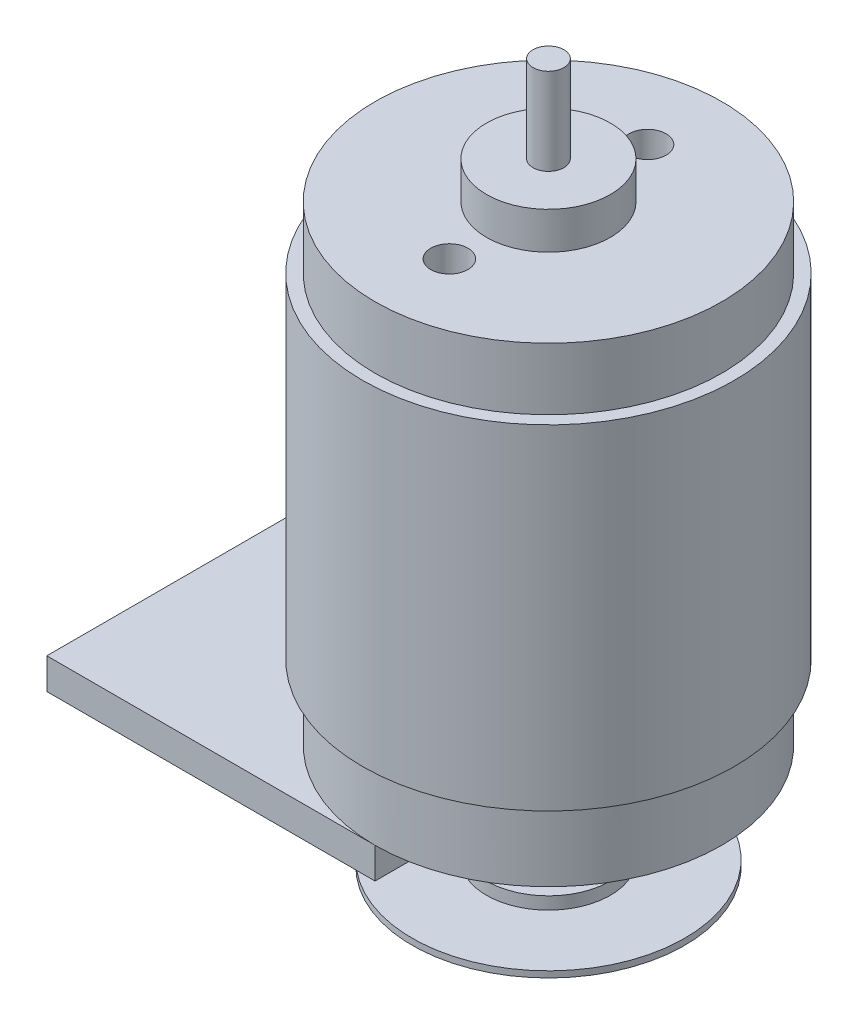
from build123d import *

# Parameters (mm, degrees)
SKETCH1_R            = 15
BOSS_EXTRUDE1_DEPTH  = 27
SKETCH2_R            = 14
BOSS_EXTRUDE2_DEPTH  = 5
SKETCH3_R            = 5
BOSS_EXTRUDE3_DEPTH  = 3
SKETCH4_R            = 1.25
BOSS_EXTRUDE4_DEPTH  = 7
BOSS_EXTRUDE5_START  = 6
SKETCH5_R            = 14
BOSS_EXTRUDE5_DEPTH  = 6
BOSS_EXTRUDE6_START  = 3
SKETCH6_R            = 5
BOSS_EXTRUDE6_DEPTH  = 3
SKETCH7_W            = 26.5
SKETCH7_H            = 28
BOSS_EXTRUDE7_DEPTH  = 2.5
BOSS_EXTRUDE8_START  = 4
SKETCH8_R            = 1.25
BOSS_EXTRUDE8_DEPTH  = 4
BOSS_EXTRUDE9_START  = 1
SKETCH9_R            = 5
BOSS_EXTRUDE9_DEPTH  = 1
SKETCH10_R           = 11
BOSS_EXTRUDE10_DEPTH = 0.5
BOSS_EXTRUDE11_START = 1
SKETCH11_R           = 5
BOSS_EXTRUDE11_DEPTH = 1
BOSS_EXTRUDE12_START = 3
SKETCH12_R           = 1.25
BOSS_EXTRUDE12_DEPTH = 3
SKETCH13_R           = 1.5
CUT_EXTRUDE1_DEPTH   = 20


with BuildPart() as part:
    # Sketch1 → Boss-Extrude1 (new body)
    with BuildSketch(Plane(origin=(0, 0, 0), x_dir=(1, 0, 0), z_dir=(0, 1, 0))):
        with Locations(Location((0, 0, 0), (0, 0, 270))):
            Circle(SKETCH1_R)
    extrude(amount=BOSS_EXTRUDE1_DEPTH)

    # Sketch2 → Boss-Extrude2 (add)
    with BuildSketch(Plane(origin=(0, 27, 0), x_dir=(1, 0, 0), z_dir=(0, 1, 0))):
        with Locations(Location((0, 0, 0), (0, 0, 270))):
            Circle(SKETCH2_R)
    extrude(amount=BOSS_EXTRUDE2_DEPTH)

    # Sketch3 → Boss-Extrude3 (add)
    with BuildSketch(Plane(origin=(0, 32, 0), x_dir=(1, 0, 0), z_dir=(0, 1, 0))):
        with Locations(Location((0, 0, 0), (0, 0, 270))):
            Circle(SKETCH3_R)
    extrude(amount=BOSS_EXTRUDE3_DEPTH)

    # Sketch4 → Boss-Extrude4 (add)
    with BuildSketch(Plane(origin=(0, 35, 0), x_dir=(1, 0, 0), z_dir=(0, 1, 0))):
        with Locations(Location((0, 0, 0), (0, 0, 270))):
            Circle(SKETCH4_R)
    extrude(amount=BOSS_EXTRUDE4_DEPTH)

    # Sketch5 → Boss-Extrude5 (add)
    with BuildSketch(Plane.XZ.offset(BOSS_EXTRUDE5_START)):
        with Locations(Location((0, 0, 0), (0, 0, 90))):
            Circle(SKETCH5_R)
    extrude(amount=-BOSS_EXTRUDE5_DEPTH)

    # Sketch6 → Boss-Extrude6 (add)
    with BuildSketch(Plane.XZ.offset(6).offset(BOSS_EXTRUDE6_START)):
        with Locations(Location((0, 0, 0), (0, 0, 90))):
            Circle(SKETCH6_R)
    extrude(amount=-BOSS_EXTRUDE6_DEPTH)

    # Sketch7 → Boss-Extrude7 (add)
    with BuildSketch(Plane.XZ.offset(6)):
        with Locations((-13.25, 0)):
            Rectangle(SKETCH7_W, SKETCH7_H)
    extrude(amount=BOSS_EXTRUDE7_DEPTH)

    # Sketch8 → Boss-Extrude8 (add)
    with BuildSketch(Plane.XZ.offset(9).offset(BOSS_EXTRUDE8_START)):
        with Locations(Location((0, 0, 0), (0, 0, 90))):
            Circle(SKETCH8_R)
    extrude(amount=-BOSS_EXTRUDE8_DEPTH)

    # Sketch9 → Boss-Extrude9 (add)
    with BuildSketch(Plane.XZ.offset(13).offset(BOSS_EXTRUDE9_START)):
        with Locations(Location((0, 0, 0), (0, 0, 270))):
            Circle(SKETCH9_R)
    extrude(amount=-BOSS_EXTRUDE9_DEPTH)

    # Sketch10 → Boss-Extrude10 (add)
    with BuildSketch(Plane.XZ.offset(14)):
        with Locations(Location((0, 0, 0), (0, 0, 270))):
            Circle(SKETCH10_R)
    extrude(amount=BOSS_EXTRUDE10_DEPTH)

    # Sketch11 → Boss-Extrude11 (add)
    with BuildSketch(Plane.XZ.offset(14.5).offset(BOSS_EXTRUDE11_START)):
        with Locations(Location((0, 0, 0), (0, 0, 270))):
            Circle(SKETCH11_R)
    extrude(amount=-BOSS_EXTRUDE11_DEPTH)

    # Sketch12 → Boss-Extrude12 (add)
    with BuildSketch(Plane.XZ.offset(15.5).offset(BOSS_EXTRUDE12_START)):
        with Locations(Location((0, 0, 0), (0, 0, 90))):
            Circle(SKETCH12_R)
    extrude(amount=-BOSS_EXTRUDE12_DEPTH)

    # Sketch13 → Cut-Extrude1 (cut)
    with BuildSketch(Plane(origin=(0, 32, 0), x_dir=(1, 0, 0), z_dir=(0, 1, 0))):
        with Locations(Location((0, 8, 0), (0, 0, 270))):
            Circle(SKETCH13_R)
        with Locations(Location((0, -8, 0), (0, 0, 270))):
            Circle(SKETCH13_R)
    extrude(amount=-CUT_EXTRUDE1_DEPTH, mode=Mode.SUBTRACT)


solid = part.part
